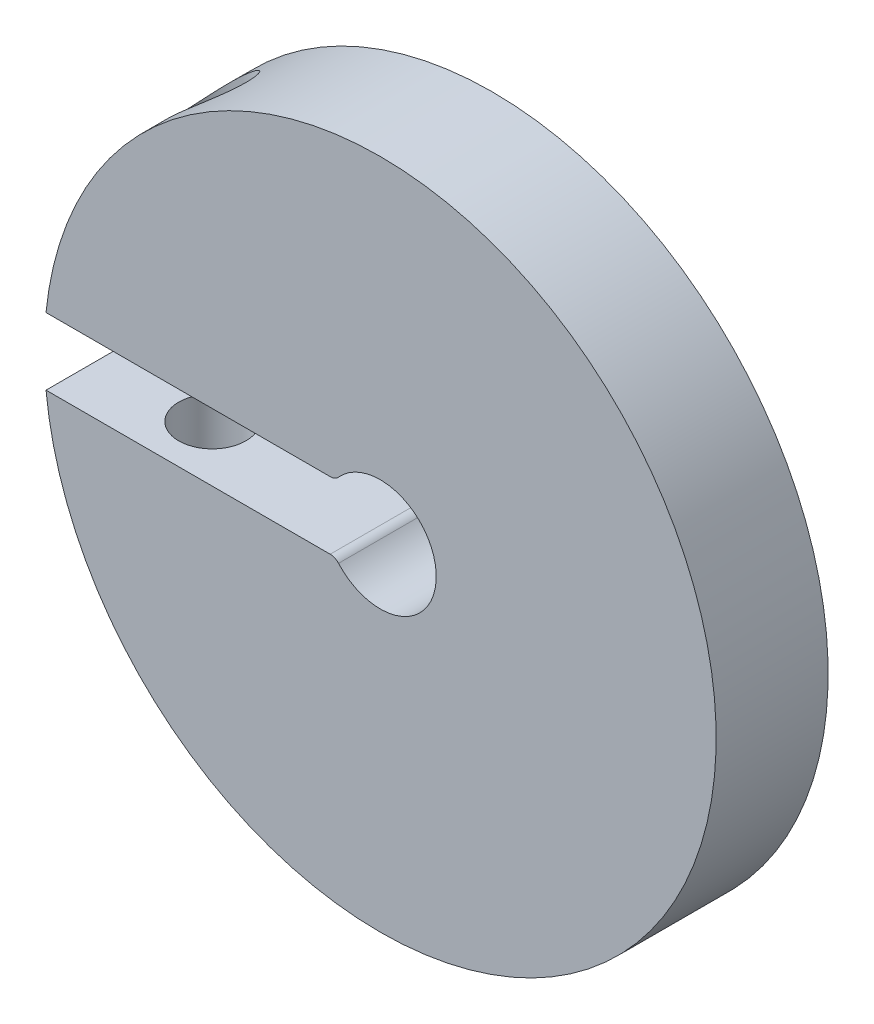
from build123d import *

# Parameters (mm, degrees)
ESQUISSE1_R                  = 15
ESQUISSE1_R_2                = 2.5
BOSS_EXTRU_1_DEPTH           = 5
ENL_V_MAT_EXTRU_1_DEPTH      = 22.794494718
ENL_V_MAT_EXTRU_1_DEPTH_BACK = 22.794494718
ESQUISSE2_R                  = 1.5
ENL_V_START                  = -10
ENL_V_MAT_EXTRU_3_DEPTH      = 10
CONG_2_R                     = 0.5


with BuildPart() as part:
    # Esquisse1 → Boss.-Extru.1 (new body)
    with BuildSketch(Plane.XY):
        Circle(ESQUISSE1_R)
        Circle(ESQUISSE1_R_2, mode=Mode.SUBTRACT)
    extrude(amount=BOSS_EXTRU_1_DEPTH)

    # Esquisse2 → Enlèv. mat.-Extru.1 (cut, two sides: drawn at the far end of the back side and taken through both)
    with BuildSketch(Plane(origin=(0, 0, 0), x_dir=(1, 0, 0), z_dir=(0, 1, 0)).offset(-ENL_V_MAT_EXTRU_1_DEPTH_BACK)):
        with Locations(Location((-10, -2.5, 0), (0, 0, 270))):
            Circle(ESQUISSE2_R)
    extrude(amount=ENL_V_MAT_EXTRU_1_DEPTH + ENL_V_MAT_EXTRU_1_DEPTH_BACK, mode=Mode.SUBTRACT)

    # Esquisse3 → Enlèv. mat.-Extru.3 (cut)
    with BuildSketch(Plane.XY.offset(5).offset(ENL_V_START)):
        with BuildLine():
            Line((-14.924811557, 1.5), (-2.5, 1.5))
            Line((-2.5, 1.5), (-2, 1.5))
            ThreePointArc((-2, 1.5), (-2.5, 0), (-2, -1.5))
            Line((-2, -1.5), (-2.5, -1.5))
            Line((-2.5, -1.5), (-14.924811557, -1.5))
            ThreePointArc((-14.924811557, -1.5), (-15, 0), (-14.924811557, 1.5))
        make_face()
    extrude(amount=ENL_V_MAT_EXTRU_3_DEPTH, mode=Mode.SUBTRACT)

    # Congé2
    cong_2_edges = [part.edges().sort_by_distance(p)[0] for p in [
        (-2, 1.5, 2.5),
        (-2, -1.5, 2.5),
    ]]
    fillet(cong_2_edges, radius=CONG_2_R)


solid = part.part
